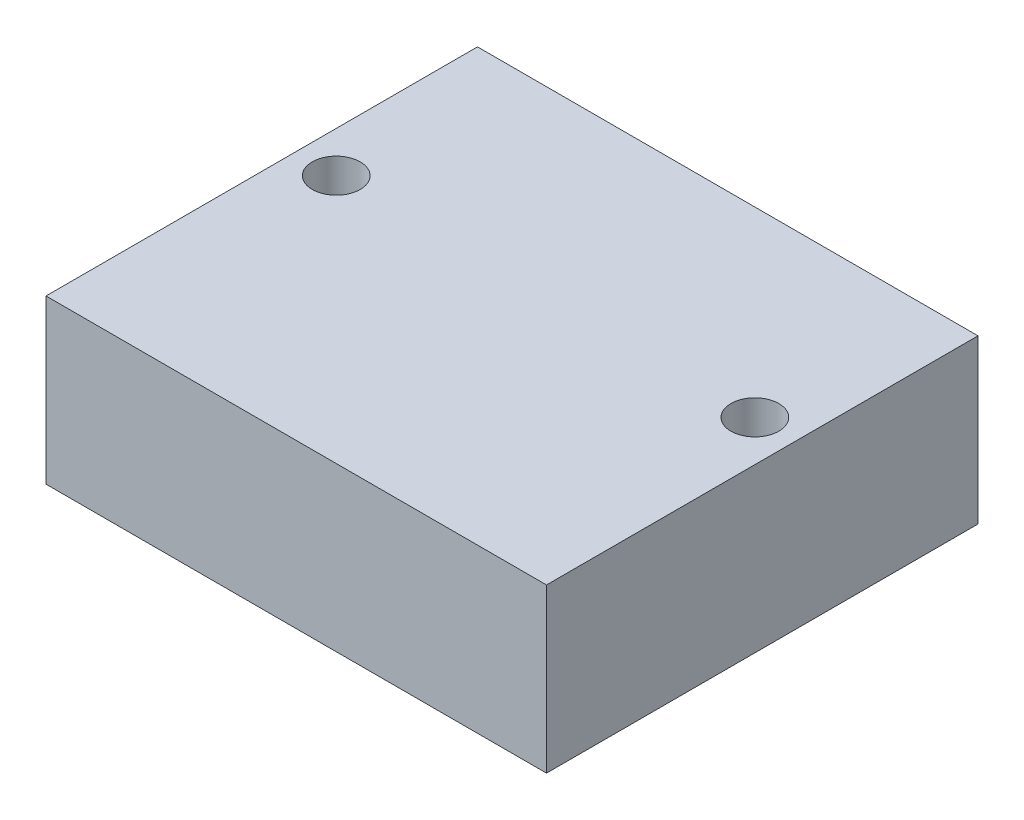
from build123d import *

# Parameters (mm, degrees)
SKETCH1_W           = 66.294
SKETCH1_H           = 57.15
BOSS_EXTRUDE1_DEPTH = 21.59
SKETCH2_R           = 3.175
CUT_EXTRUDE1_DEPTH  = 21.59


with BuildPart() as part:
    # Sketch1 → Boss-Extrude1 (new body)
    with BuildSketch(Plane(origin=(0, 0, 0), x_dir=(1, 0, 0), z_dir=(0, 1, 0))):
        Rectangle(SKETCH1_W, SKETCH1_H)
    extrude(amount=BOSS_EXTRUDE1_DEPTH)

    # Sketch2 → Cut-Extrude1 (cut)
    with BuildSketch(Plane(origin=(0, 21.59, 0), x_dir=(1, 0, 0), z_dir=(0, 1, 0))):
        with Locations(Location((-27.7241, 4.445, 0), (0, 0, 270))):
            Circle(SKETCH2_R)
        with Locations(Location((27.7241, 4.445, 0), (0, 0, 90))):
            Circle(SKETCH2_R)
    extrude(amount=-CUT_EXTRUDE1_DEPTH, mode=Mode.SUBTRACT)


solid = part.part
